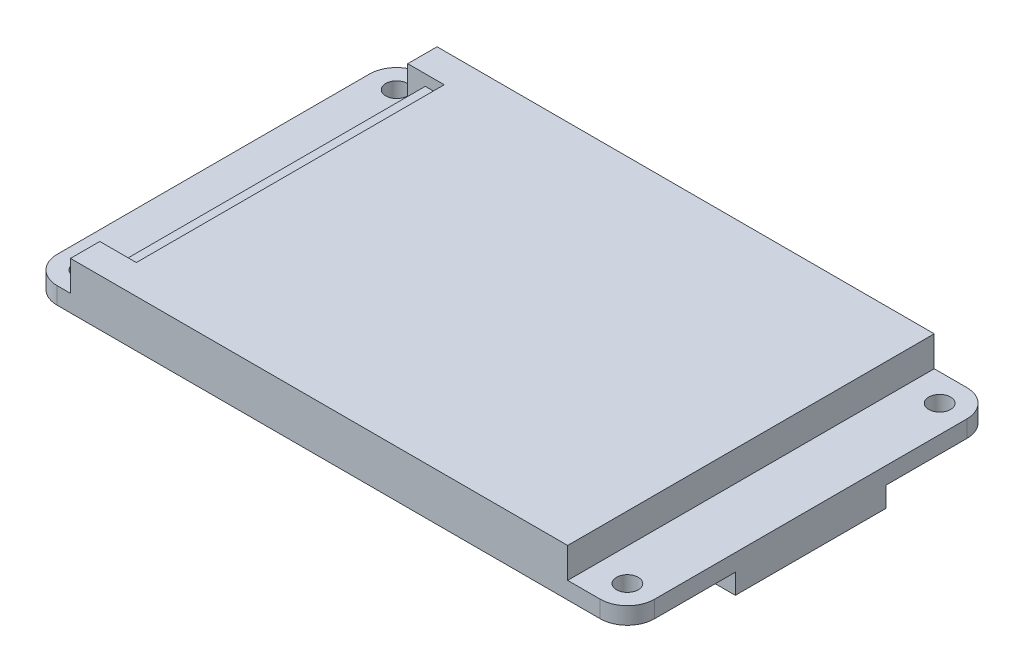
from build123d import *

# Parameters (mm, degrees)
BOSS_EXTRUDE1_DEPTH = 1.5875
BOSS_EXTRUDE2_DEPTH = 2.8321
SKETCH3_W           = 1.778
SKETCH3_H           = 28.8036
BOSS_EXTRUDE3_DEPTH = 1.8161
SKETCH4_R           = 1.016
CUT_EXTRUDE1_DEPTH  = 66.623161235
SKETCH5_W           = 2.54
SKETCH5_H           = 25.4
BOSS_EXTRUDE4_DEPTH = 2.6289
SKETCH6_W           = 16.5608
SKETCH6_H           = 14.097
BOSS_EXTRUDE5_DEPTH = 1.8796


with BuildPart() as part:
    # Sketch1 → Boss-Extrude1 (new body)
    with BuildSketch(Plane(origin=(0, 0, 0), x_dir=(1, 0, 0), z_dir=(0, 1, 0))):
        with BuildLine():
            Line((2.54, 0), (53.34, 0))
            ThreePointArc((53.34, 0), (55.136051224, 0.743948776), (55.88, 2.54))
            Line((55.88, 2.54), (55.88, 31.75))
            ThreePointArc((55.88, 31.75), (55.136051224, 33.546051224), (53.34, 34.29))
            Line((53.34, 34.29), (2.54, 34.29))
            ThreePointArc((2.54, 34.29), (0.743948776, 33.546051224), (0, 31.75))
            Line((0, 31.75), (0, 2.54))
            ThreePointArc((0, 2.54), (0.743948776, 0.743948776), (2.54, 0))
        make_face()
    extrude(amount=BOSS_EXTRUDE1_DEPTH)

    # Sketch2 → Boss-Extrude2 (add)
    with BuildSketch(Plane(origin=(0, 1.5875, 0), x_dir=(1, 0, 0), z_dir=(0, 1, 0))):
        Polygon((50.292, 34.29), (3.7846, 34.29), (3.7846, 31.5468), (7.2009, 31.5468), (7.2009, 2.7432), (3.7846, 2.7432), (3.7846, 0), (50.292, 0), align=None)
    extrude(amount=BOSS_EXTRUDE2_DEPTH)

    # Sketch3 → Boss-Extrude3 (add)
    with BuildSketch(Plane(origin=(0, 1.5875, 0), x_dir=(1, 0, 0), z_dir=(0, 1, 0))):
        with Locations((6.3119, 17.145)):
            Rectangle(SKETCH3_W, SKETCH3_H)
    extrude(amount=BOSS_EXTRUDE3_DEPTH)

    # Sketch4 → Cut-Extrude1 (cut, through all)
    with BuildSketch(Plane(origin=(0, 1.5875, 0), x_dir=(1, 0, 0), z_dir=(0, 1, 0))):
        with Locations(Location((2.54, 31.75, 0), (0, 0, 270))):
            Circle(SKETCH4_R)
        with Locations(Location((2.54, 2.54, 0), (0, 0, 270))):
            Circle(SKETCH4_R)
        with Locations(Location((53.34, 31.75, 0), (0, 0, 270))):
            Circle(SKETCH4_R)
        with Locations(Location((53.34, 2.54, 0), (0, 0, 270))):
            Circle(SKETCH4_R)
    extrude(amount=-CUT_EXTRUDE1_DEPTH, mode=Mode.SUBTRACT)

    # Sketch5 → Boss-Extrude4 (add)
    with BuildSketch(Plane.XZ):
        with Locations((2.54, -17.145)):
            Rectangle(SKETCH5_W, SKETCH5_H)
    extrude(amount=BOSS_EXTRUDE4_DEPTH)

    # Sketch6 → Boss-Extrude5 (add)
    with BuildSketch(Plane.XZ):
        with Locations((47.5996, -17.145)):
            Rectangle(SKETCH6_W, SKETCH6_H)
    extrude(amount=BOSS_EXTRUDE5_DEPTH)


solid = part.part
